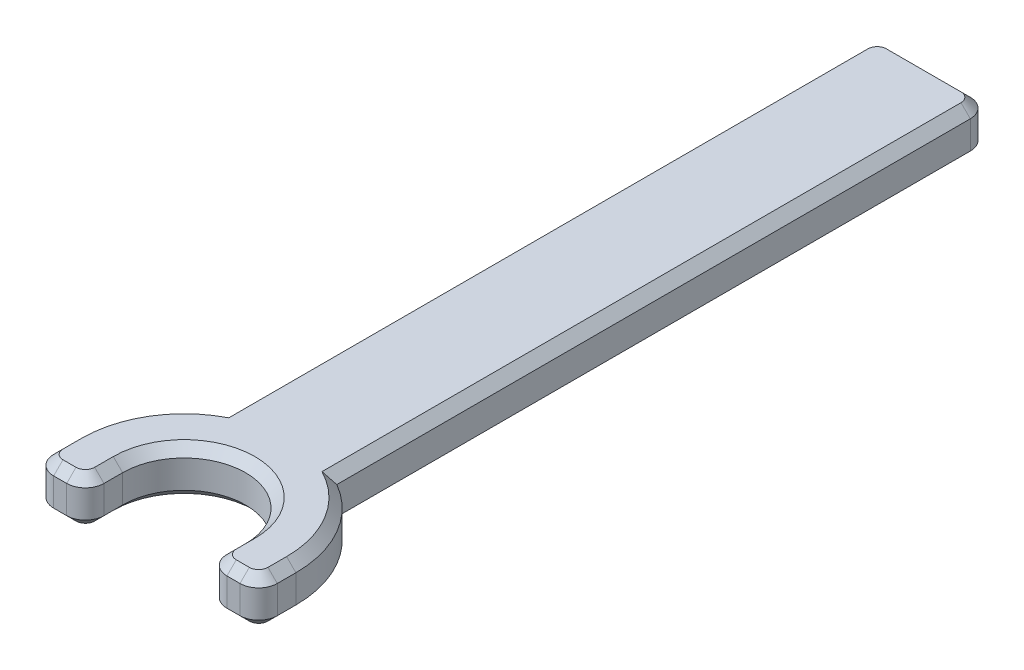
from build123d import *

# Parameters (mm, degrees)
BOSS_EXTRUDE1_DEPTH = 2.5
FILLET1_R           = 1
CHAMFER1_SIZE       = 0.5


with BuildPart() as part:
    # Sketch1 → Boss-Extrude1 (new body)
    with BuildSketch(Plane(origin=(0, 0, 0), x_dir=(1, 0, 0), z_dir=(0, 1, 0))):
        with BuildLine():
            Line((-3.3, 0), (-3.3, -2))
            Line((-3.3, -2), (-6, -2))
            Line((-6, -2), (-6, 0))
            ThreePointArc((-6, 0), (-5.196152423, 3), (-3, 5.196152423))
            Line((-3, 5.196152423), (-3, 40.196152423))
            Line((-3, 40.196152423), (3, 40.196152423))
            Line((3, 40.196152423), (3, 5.196152423))
            ThreePointArc((3, 5.196152423), (5.196152423, 3), (6, 0))
            Line((6, 0), (6, -2))
            Line((6, -2), (3.3, -2))
            Line((3.3, -2), (3.3, 0))
            ThreePointArc((3.3, 0), (0, 3.3), (-3.3, 0))
        make_face()
    extrude(amount=BOSS_EXTRUDE1_DEPTH)

    # Fillet1
    fillet1_edges = [part.edges().sort_by_distance(p)[0] for p in [
        (-3.3, 1.25, 2),
        (-6, 1.25, 2),
        (-3, 1.25, -40.196152423),
        (3, 1.25, -40.196152423),
        (6, 1.25, 2),
        (3.3, 1.25, 2),
    ]]
    fillet(fillet1_edges, radius=FILLET1_R)

    # Chamfer1
    chamfer1_edges = [part.edges().sort_by_distance(p)[0] for p in [
        (-6, 0, 0.5),
        (-5.196152423, 0, -3),
        (3, 0, -22.196152423),
        (5.196152423, 0, -3),
        (3.3, 0, 0.5),
        (0, 0, -3.3),
        (5.196152423, 2.5, -3),
        (3, 2.5, -22.196152423),
        (-3, 0, -22.196152423),
        (-3, 2.5, -22.196152423),
        (-5.196152423, 2.5, -3),
        (-3.3, 0, 0.5),
        (-4.65, 0, 2),
        (0, 0, -40.196152423),
        (6, 0, 0.5),
        (4.65, 0, 2),
        (-6, 2.5, 0.5),
        (-5.707106781, 0, 1.707106781),
        (-3.592893219, 0, 1.707106781),
        (3.592893219, 0, 1.707106781),
        (5.707106781, 0, 1.707106781),
        (2.707106781, 0, -39.903259204),
        (-2.707106781, 0, -39.903259204),
        (0, 2.5, -40.196152423),
        (4.65, 2.5, 2),
        (6, 2.5, 0.5),
        (-4.65, 2.5, 2),
        (-3.3, 2.5, 0.5),
        (-5.707106781, 2.5, 1.707106781),
        (-3.592893219, 2.5, 1.707106781),
        (0, 2.5, -3.3),
        (3.592893219, 2.5, 1.707106781),
        (5.707106781, 2.5, 1.707106781),
        (2.707106781, 2.5, -39.903259204),
        (-2.707106781, 2.5, -39.903259204),
        (3.3, 2.5, 0.5),
    ]]
    chamfer(chamfer1_edges, length=CHAMFER1_SIZE)


solid = part.part
